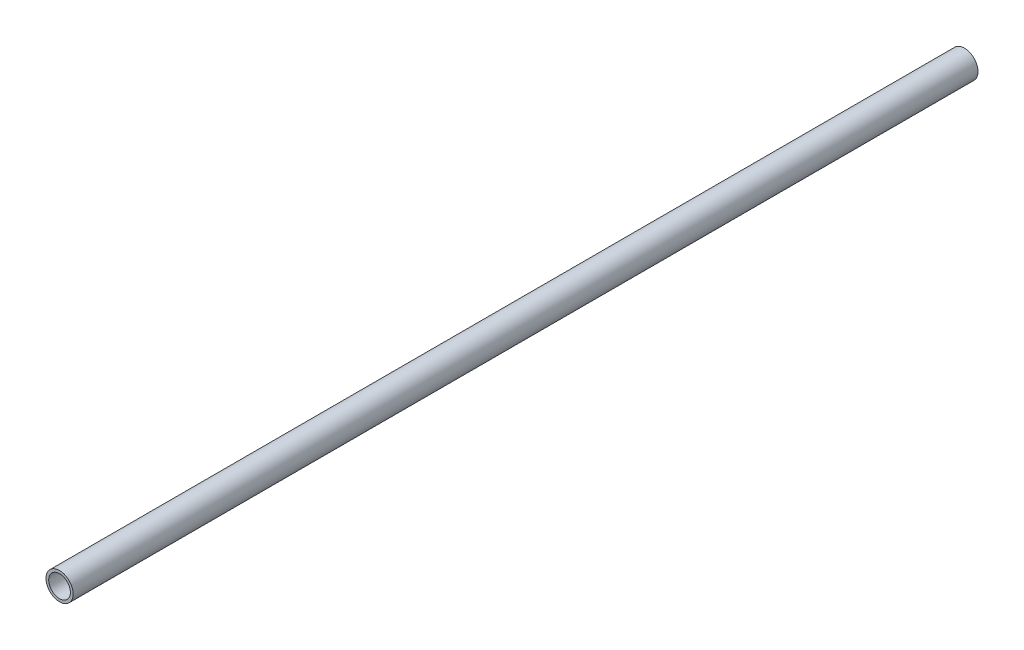
from build123d import *

# Parameters (mm, degrees)
SKETCH1_R           = 15
BOSS_EXTRUDE1_DEPTH = 1000
SKETCH2_R           = 12
CUT_EXTRUDE1_DEPTH  = 1000


with BuildPart() as part:
    # Sketch1 → Boss-Extrude1 (new body)
    with BuildSketch(Plane.XY):
        Circle(SKETCH1_R)
    extrude(amount=BOSS_EXTRUDE1_DEPTH)

    # Sketch2 → Cut-Extrude1 (cut)
    with BuildSketch(Plane.XY):
        Circle(SKETCH2_R)
    extrude(amount=CUT_EXTRUDE1_DEPTH, mode=Mode.SUBTRACT)


solid = part.part
